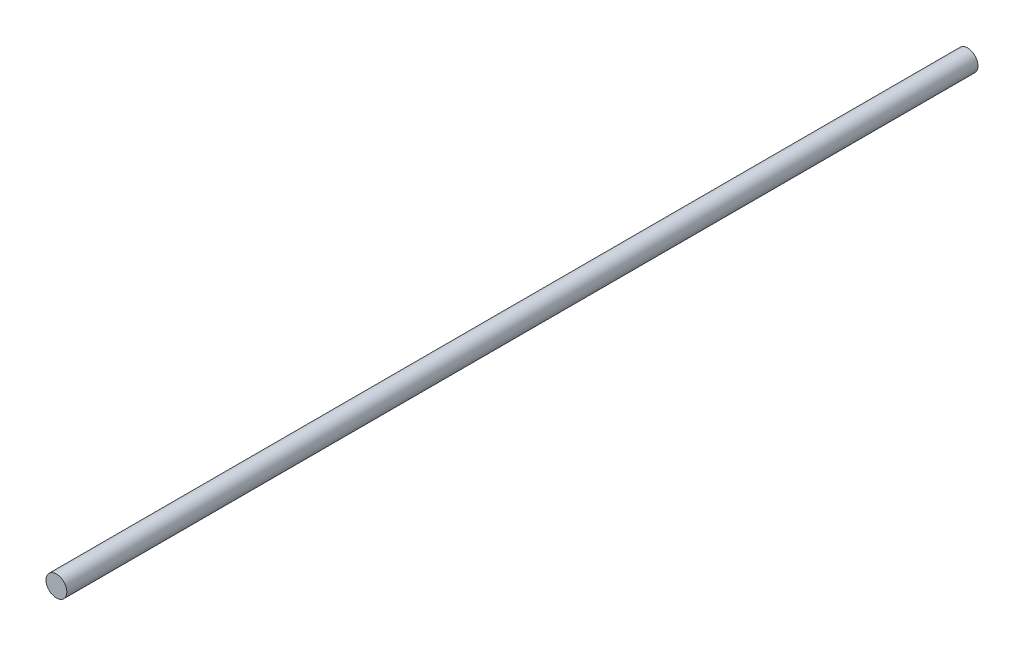
from build123d import *

# Parameters (mm, degrees)
SKETCH_1_R      = 8
EXTRUDE_1_DEPTH = 700


with BuildPart() as part:
    # 草图1 → 凸台-拉伸1 (new body)
    with BuildSketch(Plane.XY):
        Circle(SKETCH_1_R)
    extrude(amount=EXTRUDE_1_DEPTH)


solid = part.part
